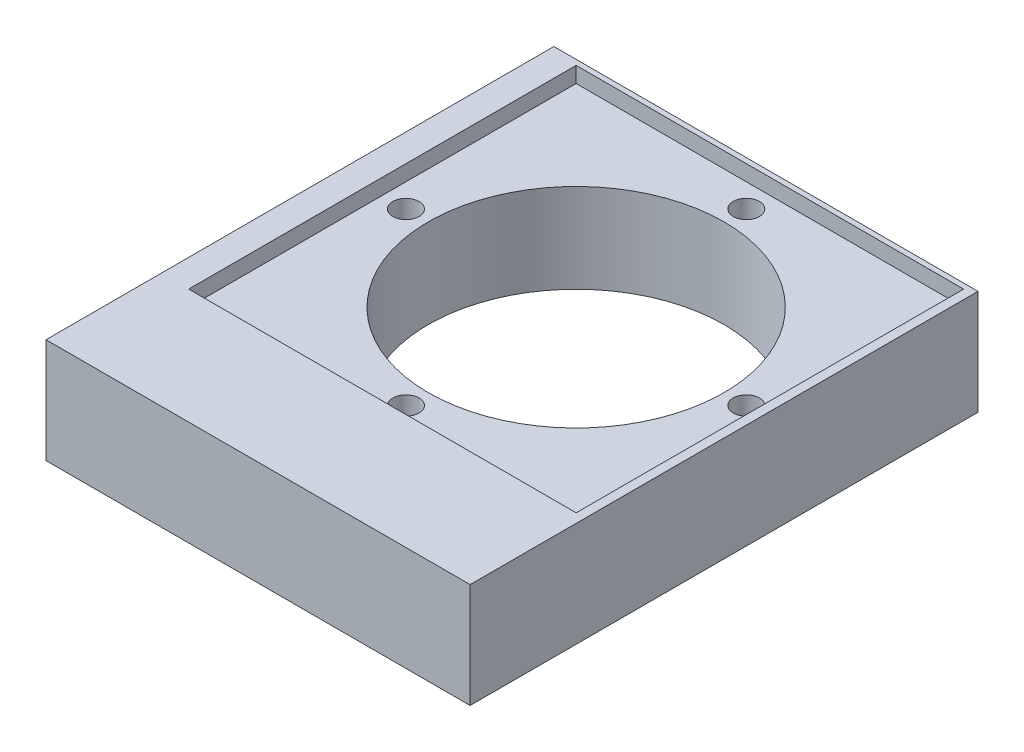
from build123d import *

# Parameters (mm, degrees)
SKETCH1_W           = 81
SKETCH1_H           = 97
BOSS_EXTRUDE1_DEPTH = 20
SKETCH2_R           = 28.25
CUT_EXTRUDE2_DEPTH  = 67.275938319
SKETCH5_W           = 74
SKETCH5_H           = 74
CUT_EXTRUDE3_DEPTH  = 3
SKETCH6_R           = 2.5
CUT_EXTRUDE4_DEPTH  = 66.433172015


with BuildPart() as part:
    # Sketch1 → Boss-Extrude1 (new body)
    with BuildSketch(Plane(origin=(0, 0, 0), x_dir=(1, 0, 0), z_dir=(0, 1, 0))):
        Rectangle(SKETCH1_W, SKETCH1_H)
    extrude(amount=BOSS_EXTRUDE1_DEPTH)

    # Sketch2 → Cut-Extrude2 (cut, through all)
    with BuildSketch(Plane(origin=(0, 20, 0), x_dir=(1, 0, 0), z_dir=(0, 1, 0))):
        with Locations(Location((1.75, 10.5, 0), (0, 0, 270))):
            Circle(SKETCH2_R)
    extrude(amount=-CUT_EXTRUDE2_DEPTH, mode=Mode.SUBTRACT)

    # Sketch5 → Cut-Extrude3 (cut)
    with BuildSketch(Plane(origin=(0, 20, 0), x_dir=(1, 0, 0), z_dir=(0, 1, 0))):
        with Locations((1.75, 10.5)):
            Rectangle(SKETCH5_W, SKETCH5_H)
    extrude(amount=-CUT_EXTRUDE3_DEPTH, mode=Mode.SUBTRACT)

    # Sketch6 → Cut-Extrude4 (cut, through all)
    with BuildSketch(Plane(origin=(0, 17, 0), x_dir=(1, 0, 0), z_dir=(0, 1, 0))):
        with Locations(Location((-30.75, 10.5, 0), (0, 0, 270))):
            Circle(SKETCH6_R)
        with Locations(Location((1.75, -22, 0), (0, 0, 270))):
            Circle(SKETCH6_R)
        with Locations(Location((34.25, 10.5, 0), (0, 0, 270))):
            Circle(SKETCH6_R)
        with Locations(Location((1.75, 43, 0), (0, 0, 270))):
            Circle(SKETCH6_R)
    extrude(amount=-CUT_EXTRUDE4_DEPTH, mode=Mode.SUBTRACT)


solid = part.part
